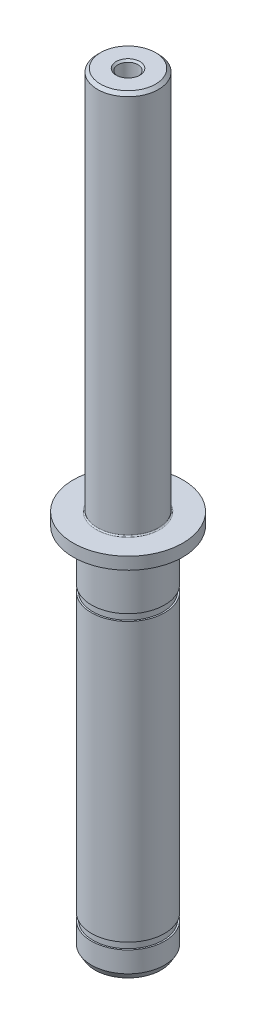
from build123d import *

# Parameters (mm, degrees)
ZKOSEN_1_SIZE   = 0.5
ZKOSEN_2_SIZE   = 1
ZKOSEN_2_SIZE2  = 0.577350269
ZAOBLIT3_R      = 0.2
M4_Z_VIT1_D     = 3.3
M4_Z_VIT1_DEPTH = 12
M4_Z_VIT1_TIP   = 0.991420021
ZKOSEN_4_SIZE   = 0.3


with BuildPart() as part:
    # Skica1 → Rotovat1 (revolve)
    with BuildSketch(Plane.XY, mode=Mode.PRIVATE) as rotovat1_sk:
        Polygon((-6, 0), (-6, 4.4), (-5.75, 4.4), (-5.75, 5.5), (-6, 5.5), (-6, 51.1), (-5.75, 51.1), (-5.75, 52.2), (-6, 52.2), (-6, 60.5), (-9, 60.5), (-9, 62.5), (-5, 62.5), (-5, 125.5), (0, 125.5), (0, 0), align=None)
    revolve(rotovat1_sk.sketch.rotate(Axis((0, 0, 0), (0, 1, 0)), 270), axis=Axis((0, 0, 0), (0, 1, 0)))

    # Zkosení1
    zkosen_1_edges = [part.edges().sort_by_distance(p)[0] for p in [
        (0, 125.5, 5),
    ]]
    chamfer(zkosen_1_edges, length=ZKOSEN_1_SIZE)

    # Zkosení2
    zkosen_2_edges = [part.edges().sort_by_distance(p)[0] for p in [
        (0, 0, 6),
    ]]
    zkosen_2_side = [part.faces().sort_by_distance(p)[0] for p in [
        (0, 2.2, 6),
    ]]
    chamfer(zkosen_2_edges, length=ZKOSEN_2_SIZE, length2=ZKOSEN_2_SIZE2, reference=zkosen_2_side[0])

    # Zaoblit3
    zaoblit3_edges = [part.edges().sort_by_distance(p)[0] for p in [
        (0, 62.5, 5),
    ]]
    fillet(zaoblit3_edges, radius=ZAOBLIT3_R)

    # M4 závit1
    with Locations(Plane(origin=(0, 125.5, 0), x_dir=(1, 0, 0), z_dir=(0, 1, 0))):
        with Locations((0, 0)):
            Hole(M4_Z_VIT1_D / 2, depth=M4_Z_VIT1_DEPTH)
            with Locations((0, 0, -(M4_Z_VIT1_DEPTH + M4_Z_VIT1_TIP / 2))):  # 118° drill point
                Cone(0, M4_Z_VIT1_D / 2, M4_Z_VIT1_TIP, mode=Mode.SUBTRACT)

    # Zkosení4
    zkosen_4_edges = [part.edges().sort_by_distance(p)[0] for p in [
        (1.65, 125.5, 0),
    ]]
    chamfer(zkosen_4_edges, length=ZKOSEN_4_SIZE)


solid = part.part
